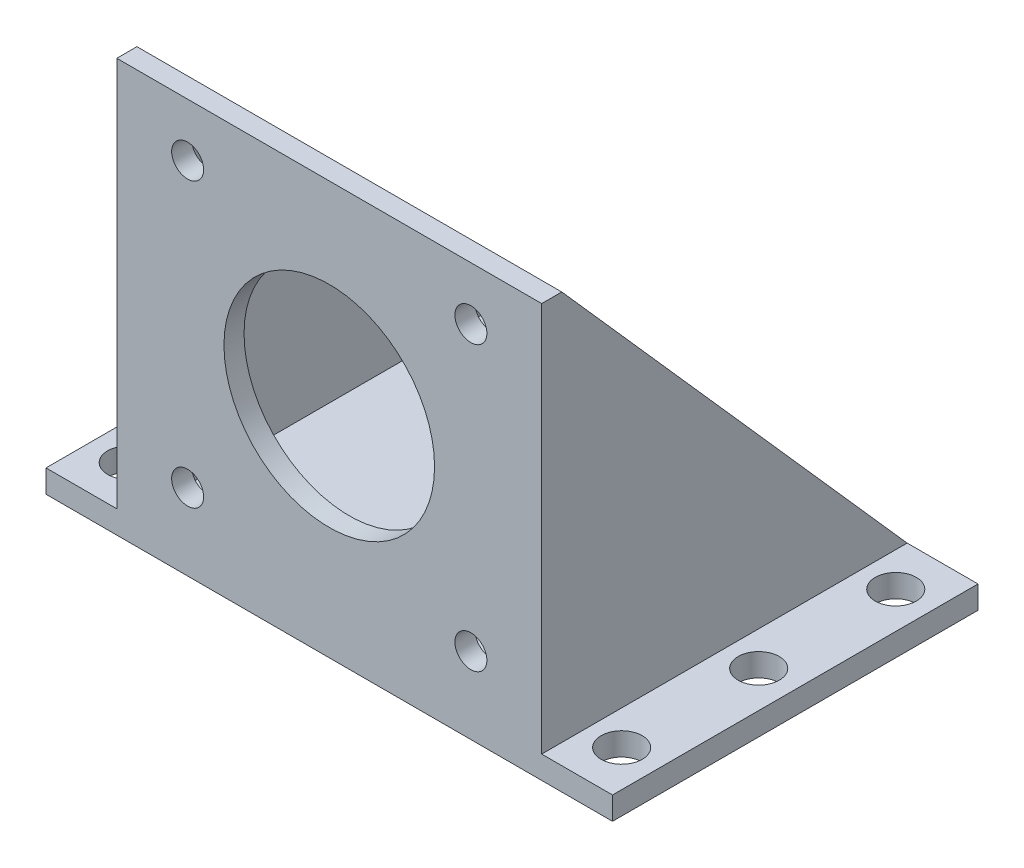
from build123d import *

# Parameters (mm, degrees)
SKETCH_1_W      = 62
SKETCH_1_H      = 40
SKETCH_1_R      = 2.25
EXTRUDE_1_DEPTH = 2.5
SKETCH_2_W      = 46.5
SKETCH_2_H      = 42.7
SKETCH_2_R      = 11.525
SKETCH_2_R_2    = 1.75
EXTRUDE_2_DEPTH = 2.2
EXTRUDE_3_DEPTH = 1.6
EXTRUDE_4_DEPTH = 1.6


with BuildPart() as part:
    # Эскиз1 → Бобышка-Вытянуть1 (new body)
    with BuildSketch(Plane(origin=(0, 0, 0), x_dir=(1, 0, 0), z_dir=(0, 1, 0))):
        Rectangle(SKETCH_1_W, SKETCH_1_H)
        with Locations(Location((-27, 0, 0), (0, 0, 270))):
            Circle(SKETCH_1_R, mode=Mode.SUBTRACT)
        with Locations(Location((27, 0, 0), (0, 0, 270))):
            Circle(SKETCH_1_R, mode=Mode.SUBTRACT)
        with Locations(Location((-27, 15, 0), (0, 0, 270))):
            Circle(SKETCH_1_R, mode=Mode.SUBTRACT)
        with Locations(Location((27, 15, 0), (0, 0, 270))):
            Circle(SKETCH_1_R, mode=Mode.SUBTRACT)
        with Locations(Location((-27, -15, 0), (0, 0, 270))):
            Circle(SKETCH_1_R, mode=Mode.SUBTRACT)
        with Locations(Location((27, -15, 0), (0, 0, 270))):
            Circle(SKETCH_1_R, mode=Mode.SUBTRACT)
    extrude(amount=EXTRUDE_1_DEPTH)

    # Эскиз2 → Бобышка-Вытянуть2 (add)
    with BuildSketch(Plane.XY.offset(20)):
        with Locations((0, 23.85)):
            Rectangle(SKETCH_2_W, SKETCH_2_H)
        with Locations((0, 23.875)):
            Circle(SKETCH_2_R, mode=Mode.SUBTRACT)
        with Locations((15.5, 39.375)):
            Circle(SKETCH_2_R_2, mode=Mode.SUBTRACT)
        with Locations((15.5, 8.375)):
            Circle(SKETCH_2_R_2, mode=Mode.SUBTRACT)
        with Locations((-15.5, 8.375)):
            Circle(SKETCH_2_R_2, mode=Mode.SUBTRACT)
        with Locations((-15.5, 39.375)):
            Circle(SKETCH_2_R_2, mode=Mode.SUBTRACT)
    extrude(amount=-EXTRUDE_2_DEPTH)

    # Эскиз3 → Бобышка-Вытянуть3 (add)
    with BuildSketch(Plane.ZY.offset(23.25)):
        Polygon((-20, 2.5), (17.8, 45.2), (17.8, 2.5), align=None)
    extrude(amount=-EXTRUDE_3_DEPTH)

    # Эскиз4 → Бобышка-Вытянуть4 (add)
    with BuildSketch(Plane(origin=(23.25, 0, 0), x_dir=(0, 0, -1), z_dir=(1, 0, 0))):
        Polygon((-17.8, 2.5), (20, 2.5), (-17.8, 45.2), align=None)
    extrude(amount=-EXTRUDE_4_DEPTH)


solid = part.part
